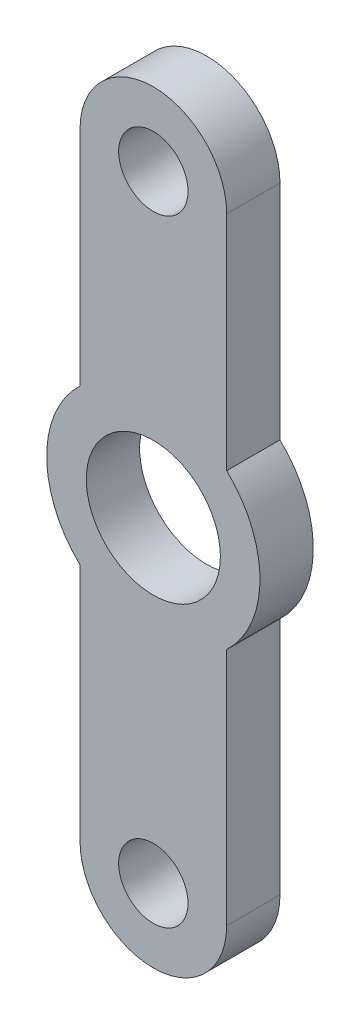
from build123d import *

# Parameters (mm, degrees)
SKETCH_1_R      = 2.6
SKETCH_1_R_2    = 5.03
EXTRUDE_1_DEPTH = 4


with BuildPart() as part:
    # 草图1 → 凸台-拉伸1 (new body)
    with BuildSketch(Plane.XY):
        with BuildLine():
            Line((5.5, 22.5), (5.5, 5.809475019))
            ThreePointArc((5.5, 5.809475019), (8, 0), (5.5, -5.809475019))
            Line((5.5, -5.809475019), (5.5, -23.75))
            ThreePointArc((5.5, -23.75), (0, -29.25), (-5.5, -23.75))
            Line((-5.5, -23.75), (-5.5, -5.809475019))
            ThreePointArc((-5.5, -5.809475019), (-8, 0), (-5.5, 5.809475019))
            Line((-5.5, 5.809475019), (-5.5, 22.5))
            ThreePointArc((-5.5, 22.5), (0, 28), (5.5, 22.5))
        make_face()
        with Locations((0, 22.5)):
            Circle(SKETCH_1_R, mode=Mode.SUBTRACT)
        with Locations((0, -23.75)):
            Circle(SKETCH_1_R, mode=Mode.SUBTRACT)
        Circle(SKETCH_1_R_2, mode=Mode.SUBTRACT)
    extrude(amount=EXTRUDE_1_DEPTH)


solid = part.part
